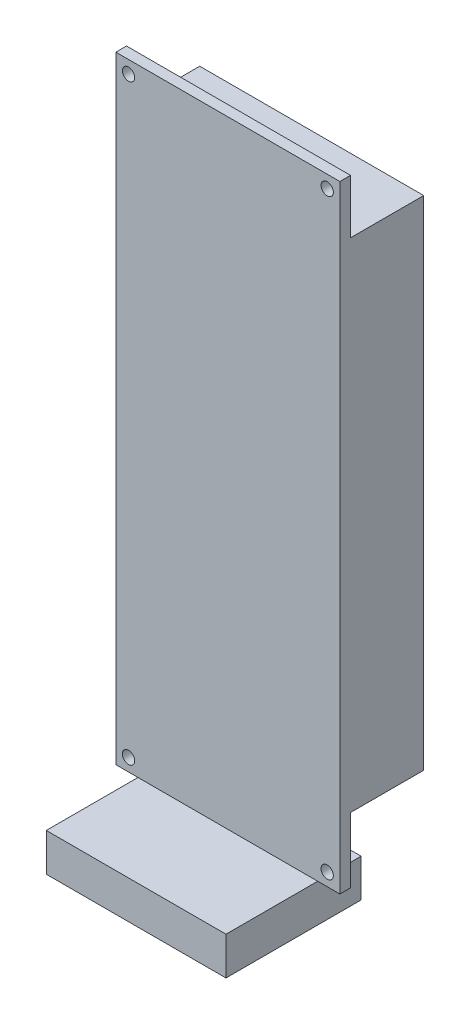
from build123d import *

# Parameters (mm, degrees)
SKETCH1_W           = 33.655
SKETCH1_H           = 92.71
SKETCH1_R           = 0.925
BOSS_EXTRUDE1_DEPTH = 1.6
SKETCH2_W           = 33.655
SKETCH2_H           = 74.776129116
BOSS_EXTRUDE2_DEPTH = 11
SKETCH3_W           = 27
SKETCH3_H           = 20.3
BOSS_EXTRUDE3_DEPTH = 5.7


with BuildPart() as part:
    # Sketch1 → Boss-Extrude1 (new body)
    with BuildSketch(Plane.XY):
        with Locations((16.8275, 46.355)):
            Rectangle(SKETCH1_W, SKETCH1_H)
        with Locations((1.905, 90.805)):
            Circle(SKETCH1_R, mode=Mode.SUBTRACT)
        with Locations((31.75, 90.805)):
            Circle(SKETCH1_R, mode=Mode.SUBTRACT)
        with Locations((1.905, 1.905)):
            Circle(SKETCH1_R, mode=Mode.SUBTRACT)
        with Locations((31.75, 1.905)):
            Circle(SKETCH1_R, mode=Mode.SUBTRACT)
    extrude(amount=BOSS_EXTRUDE1_DEPTH)

    # Sketch2 → Boss-Extrude2 (add)
    with BuildSketch(Plane(origin=(0, 0, 0), x_dir=(-1, 0, 0), z_dir=(0, 0, -1))):
        with Locations((-16.8275, 47.192358669)):
            Rectangle(SKETCH2_W, SKETCH2_H)
    extrude(amount=BOSS_EXTRUDE2_DEPTH)

    # Sketch3 → Boss-Extrude3 (add)
    with BuildSketch(Plane.XZ):
        with Locations((16.825, 5.23)):
            Rectangle(SKETCH3_W, SKETCH3_H)
    extrude(amount=BOSS_EXTRUDE3_DEPTH)


solid = part.part
